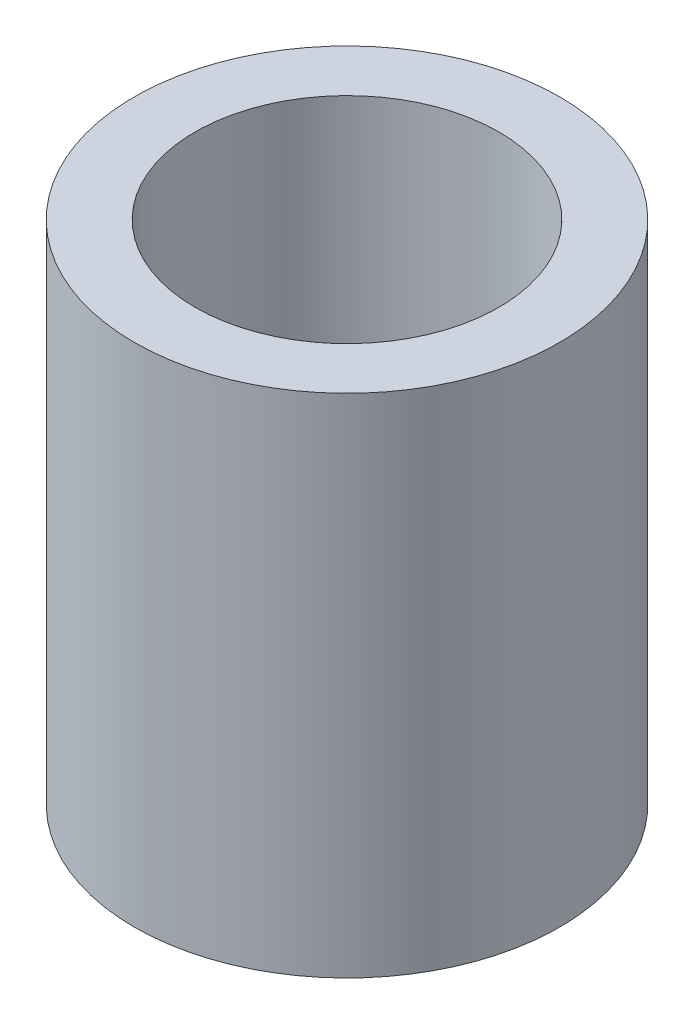
from build123d import *

# Parameters (mm, degrees)
SKETCH1_R           = 2.1
SKETCH1_R_2         = 1.5
BOSS_EXTRUDE1_DEPTH = 5


with BuildPart() as part:
    # Sketch1 → Boss-Extrude1 (new body)
    with BuildSketch(Plane(origin=(0, 0, 0), x_dir=(1, 0, 0), z_dir=(0, 1, 0))):
        with Locations(Location((0, 0, 0), (0, 0, 270))):
            Circle(SKETCH1_R)
        with Locations(Location((0, 0, 0), (0, 0, 270))):
            Circle(SKETCH1_R_2, mode=Mode.SUBTRACT)
    extrude(amount=BOSS_EXTRUDE1_DEPTH)


solid = part.part
